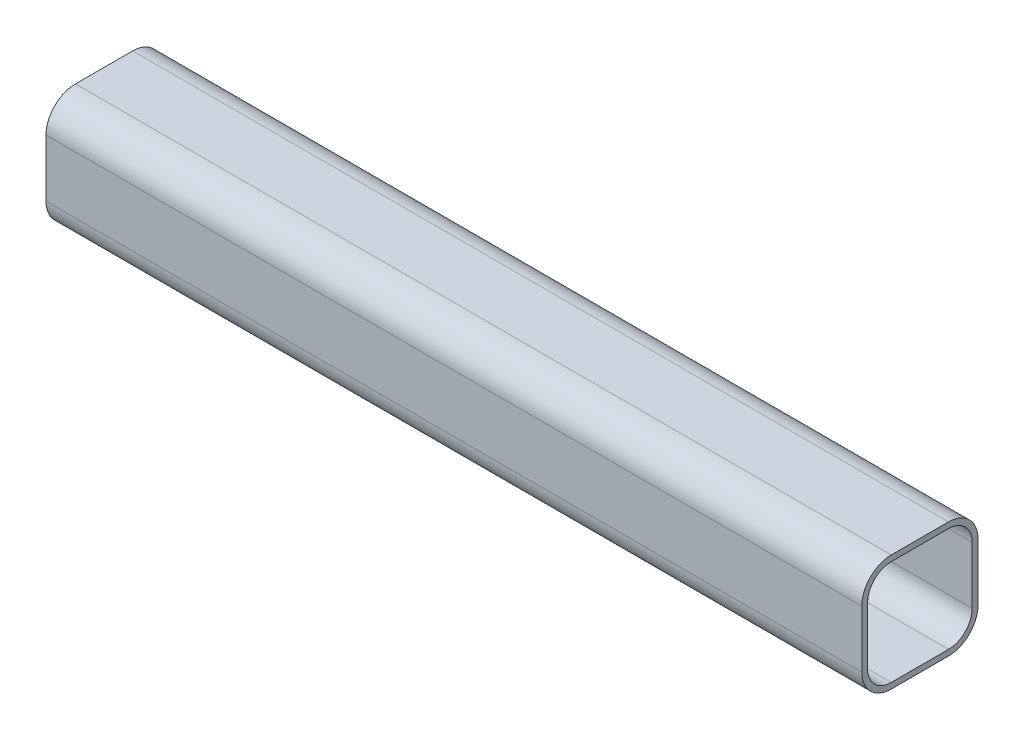
from build123d import *

# Parameters (mm, degrees)
MIEMBRO_ESTRUCTURAL1_DEPTH = 351


with BuildPart() as part:
    # Sketch11 → Miembro estructural1 (new body)
    with BuildSketch(Plane.YZ.offset(-136.213834658)):
        with BuildLine():
            Line((-12.3, -25), (12.3, -25))
            ThreePointArc((12.3, -25), (21.280256121, -21.280256121), (25, -12.3))
            Line((25, -12.3), (25, 12.3))
            ThreePointArc((25, 12.3), (21.280256121, 21.280256121), (12.3, 25))
            Line((12.3, 25), (-12.3, 25))
            ThreePointArc((-12.3, 25), (-21.280256121, 21.280256121), (-25, 12.3))
            Line((-25, 12.3), (-25, -12.3))
            ThreePointArc((-25, -12.3), (-21.280256121, -21.280256121), (-12.3, -25))
        make_face()
        with BuildLine():
            Line((-12.3, -22.5), (12.3, -22.5))
            ThreePointArc((12.3, -22.5), (19.512489168, -19.512489168), (22.5, -12.3))
            Line((22.5, -12.3), (22.5, 12.3))
            ThreePointArc((22.5, 12.3), (19.512489168, 19.512489168), (12.3, 22.5))
            Line((12.3, 22.5), (-12.3, 22.5))
            ThreePointArc((-12.3, 22.5), (-19.512489168, 19.512489168), (-22.5, 12.3))
            Line((-22.5, 12.3), (-22.5, -12.3))
            ThreePointArc((-22.5, -12.3), (-19.512489168, -19.512489168), (-12.3, -22.5))
        make_face(mode=Mode.SUBTRACT)
    extrude(amount=MIEMBRO_ESTRUCTURAL1_DEPTH)


solid = part.part
